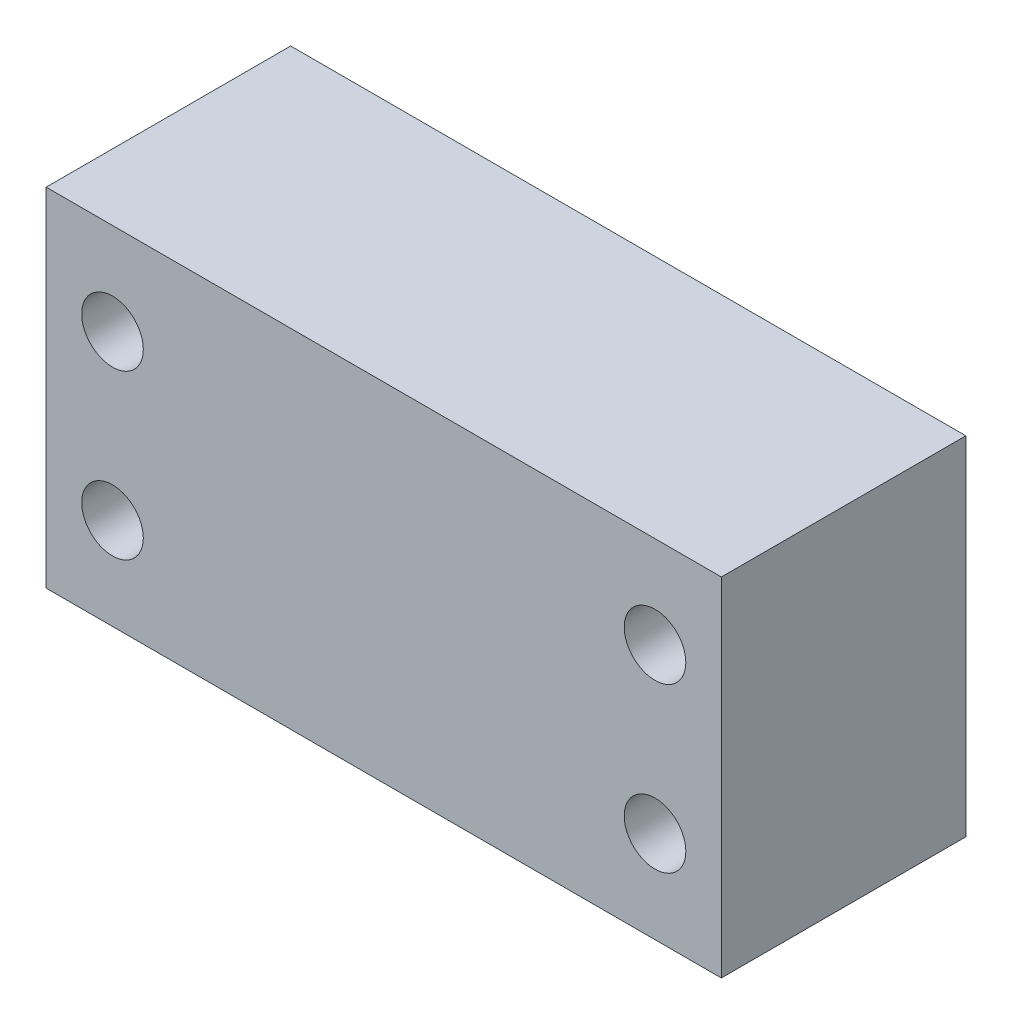
from build123d import *

# Parameters (mm, degrees)
SKETCH1_W           = 36.195
SKETCH1_H           = 18.6182
BOSS_EXTRUDE1_DEPTH = 13.1064
SKETCH4_R           = 1.651
CUT_EXTRUDE1_DEPTH  = 25.206539819


with BuildPart() as part:
    # Sketch1 → Boss-Extrude1 (new body)
    with BuildSketch(Plane.XY):
        Rectangle(SKETCH1_W, SKETCH1_H)
    extrude(amount=BOSS_EXTRUDE1_DEPTH)

    # Sketch4 → Cut-Extrude1 (cut, through all)
    with BuildSketch(Plane.XY.offset(13.1064)):
        with Locations((-14.5415, 4.3815)):
            Circle(SKETCH4_R)
        with Locations((14.5415, 4.3815)):
            Circle(SKETCH4_R)
        with Locations((14.5415, -4.3815)):
            Circle(SKETCH4_R)
        with Locations((-14.5415, -4.3815)):
            Circle(SKETCH4_R)
    extrude(amount=-CUT_EXTRUDE1_DEPTH, mode=Mode.SUBTRACT)


solid = part.part
